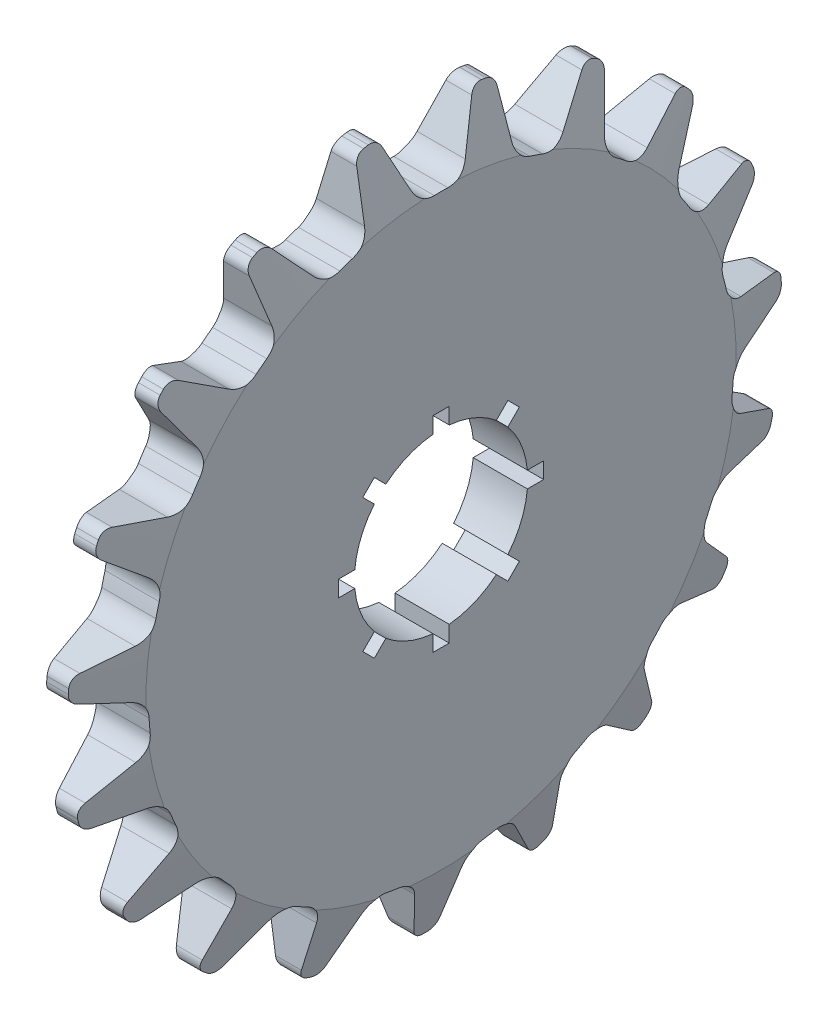
from build123d import *

# Parameters (mm, degrees)
SKETCH1_R                = 27
SKETCH1_R_2              = 22
SKETCH1_R_3              = 12
SKETCH1_R_4              = 8
BOSS_EXTRUDE1_DEPTH      = 2.5
BOSS_EXTRUDE2_DEPTH      = 5
FILLET1_R                = 1
FILLET2_R                = 2
CIRPATTERN1_COUNT        = 19
FILLET1_OF_CIRPATTERN1_R = 1
FILLET2_OF_CIRPATTERN1_R = 2
CUT_EXTRUDE1_DEPTH       = 47.87134803
CIRPATTERN2_COUNT        = 8
SKETCH1_3_R              = 22
SKETCH1_3_R_2            = 12
BOSS_EXTRUDE3_DEPTH      = 3.5
BOSS_EXTRUDE4_DEPTH      = 2
CIRPATTERN3_COUNT        = 3


with BuildPart() as part:
    # Sketch1 → Boss-Extrude1 (new, symmetric)
    # profile 1 of 3: a face of its own
    with BuildSketch(Plane.YZ):
        with Locations(Location((0, 0, 0), (0, 0, 270))):
            Circle(SKETCH1_R)
        Circle(SKETCH1_R_2, mode=Mode.SUBTRACT)
    # profile 2 of 3: a face of its own
    with BuildSketch(Plane.YZ):
        Circle(SKETCH1_R_2)
        Circle(SKETCH1_R_3, mode=Mode.SUBTRACT)
    # profile 3 of 3: a face of its own
    with BuildSketch(Plane.YZ):
        Circle(SKETCH1_R_3)
        with Locations(Location((0, 0, 0), (0, 0, 270))):
            Circle(SKETCH1_R_4, mode=Mode.SUBTRACT)
    extrude(amount=BOSS_EXTRUDE1_DEPTH, both=True)

    # Sketch2 → Boss-Extrude2 (add)
    with BuildSketch(Plane.YZ.offset(2.5)):
        with BuildLine():
            ThreePointArc((-32.984731261, 1.003744792), (-32.996182595, 0.501930459), (-33, 0))
            ThreePointArc((-33, 0), (-32.996182595, -0.501930459), (-32.984731261, -1.003744792))
            Line((-32.984731261, -1.003744792), (-26.884010118, -2.5))
            ThreePointArc((-26.884010118, -2.5), (-27, 0), (-26.884010118, 2.5))
            Line((-26.884010118, 2.5), (-32.984731261, 1.003744792))
        make_face()
    boss_extrude2 = extrude(amount=-BOSS_EXTRUDE2_DEPTH)

    # Fillet1
    fillet1_edges = [part.edges().sort_by_distance(p)[0] for p in [
        (0, -32.984731261, 1.003744792),
        (0, -32.984731261, -1.003744792),
    ]]
    fillet(fillet1_edges, radius=FILLET1_R)

    # Fillet2
    fillet2_edges = [part.edges().sort_by_distance(p)[0] for p in [
        (0, -26.884010118, 2.5),
        (0, -26.884010118, -2.5),
    ]]
    fillet(fillet2_edges, radius=FILLET2_R)

    # CirPattern1: Boss-Extrude2 ×19 about axis
    cirpattern1_axis = Axis((0, 0, 0), (1, 0, 0))
    for i in range(1, CIRPATTERN1_COUNT):
        add(boss_extrude2.rotate(cirpattern1_axis, i * 360 / CIRPATTERN1_COUNT))

    # Fillet1 of CirPattern1
    fillet1_of_cirpattern1_edges = [part.edges().sort_by_distance(p)[0] for p in [
        (0, -31.523442941, -9.760765602),
        (0, -30.871612139, -11.659483863),
        (0, -26.646100441, -19.467545589),
        (0, -25.413074819, -21.051736942),
        (0, -18.881239502, -27.064714942),
        (0, -17.200636517, -28.162707672),
        (0, -9.07030329, -31.729002478),
        (0, -7.124242354, -32.221812036),
        (0, 1.723541024, -32.954960269),
        (0, 3.724174012, -32.789183093),
        (0, 12.330612924, -30.609736766),
        (0, 14.169018338, -29.803337386),
        (0, 21.601471585, -24.947473326),
        (0, 23.078429672, -23.587837626),
        (0, 28.531475618, -16.581764051),
        (0, 29.486935052, -14.816229657),
        (0, 32.369651557, -6.419163348),
        (0, 32.700073482, -4.439053307),
        (0, 32.700073482, 4.439053307),
        (0, 32.369651557, 6.419163348),
        (0, 29.486935052, 14.816229657),
        (0, 28.531475618, 16.581764051),
        (0, 23.078429672, 23.587837626),
        (0, 21.601471585, 24.947473326),
        (0, 14.169018338, 29.803337386),
        (0, 12.330612924, 30.609736766),
        (0, 3.724174012, 32.789183093),
        (0, 1.723541024, 32.954960269),
        (0, -7.124242354, 32.221812036),
        (0, -9.07030329, 31.729002478),
        (0, -17.200636517, 28.162707672),
        (0, -18.881239502, 27.064714942),
        (0, -25.413074819, 21.051736942),
        (0, -26.646100441, 19.467545589),
        (0, -30.871612139, 11.659483863),
        (0, -31.523442941, 9.760765602),
    ]]
    fillet(fillet1_of_cirpattern1_edges, radius=FILLET1_OF_CIRPATTERN1_R)

    # Fillet2 of CirPattern1
    fillet2_of_cirpattern1_edges = [part.edges().sort_by_distance(p)[0] for p in [
        (0, -26.239108968, -6.364680711),
        (0, -24.615611622, -11.09376692),
        (0, -22.75079322, -14.539649509),
        (0, -19.679729657, -18.485352056),
        (0, -16.797076012, -21.139021676),
        (0, -12.611243621, -23.873762467),
        (0, -9.023134985, -25.44765284),
        (0, -4.176133655, -26.675080275),
        (0, -0.271397273, -26.998635957),
        (0, 4.711525192, -26.585739229),
        (0, 8.509750544, -25.623897941),
        (0, 13.088617177, -23.615420818),
        (0, 16.368734847, -21.472412987),
        (0, 20.047354401, -18.086005129),
        (0, 22.453912743, -14.994058908),
        (0, 24.833649708, -10.596690152),
        (0, 26.105860785, -6.890865889),
        (0, 26.928833736, -1.959059372),
        (0, 26.928833736, 1.959059372),
        (0, 26.105860785, 6.890865889),
        (0, 24.833649708, 10.596690152),
        (0, 22.453912743, 14.994058908),
        (0, 20.047354401, 18.086005129),
        (0, 16.368734847, 21.472412987),
        (0, 13.088617177, 23.615420818),
        (0, 8.509750544, 25.623897941),
        (0, 4.711525192, 26.585739229),
        (0, -0.271397273, 26.998635957),
        (0, -4.176133655, 26.675080275),
        (0, -9.023134985, 25.44765284),
        (0, -12.611243621, 23.873762467),
        (0, -16.797076012, 21.139021676),
        (0, -19.679729657, 18.485352056),
        (0, -22.75079322, 14.539649509),
        (0, -24.615611622, 11.09376692),
        (0, -26.239108968, 6.364680711),
    ]]
    fillet(fillet2_of_cirpattern1_edges, radius=FILLET2_OF_CIRPATTERN1_R)

    # Sketch3 → Cut-Revolve1 (revolve, cut)
    with BuildSketch(Plane(origin=(0, 0, 0), x_dir=(-1, 0, 0), z_dir=(0, 0, 1))):
        Polygon((1, 33), (2.5, 33), (2.5, 27.241411309), align=None)
        Polygon((-1, 33), (-2.5, 33), (-2.5, 27.241411309), align=None)
    revolve(axis=Axis((14.362974642, 0, 0), (-1, 0, 0)), mode=Mode.SUBTRACT)

    # Sketch4 → Cut-Extrude1 (cut, symmetric)
    with BuildSketch(Plane(origin=(-2.5, 0, 0), x_dir=(0, -1, 0), z_dir=(-1, 0, 0))):
        with BuildLine():
            ThreePointArc((-0.75, 7.964766161), (-0.37541358, 7.991186686), (0, 8))
            Line((0, 8), (0, 9.464766161))
            Line((0, 9.464766161), (-0.75, 9.464766161))
            Line((-0.75, 9.464766161), (-0.75, 7.964766161))
        make_face()
        with BuildLine():
            Line((0, 9.464766161), (0, 8))
            ThreePointArc((0, 8), (0.37541358, 7.991186686), (0.75, 7.964766161))
            Line((0.75, 7.964766161), (0.75, 9.464766161))
            Line((0.75, 9.464766161), (0, 9.464766161))
        make_face()
    cut_extrude1 = extrude(amount=CUT_EXTRUDE1_DEPTH, both=True, mode=Mode.SUBTRACT)

    # CirPattern2: Cut-Extrude1 ×8 about axis
    cirpattern2_axis = Axis((0, 0, 0), (1, 0, 0))
    for i in range(1, CIRPATTERN2_COUNT):
        add(cut_extrude1.rotate(cirpattern2_axis, i * 360 / CIRPATTERN2_COUNT), mode=Mode.SUBTRACT)

    # Sketch1<3> → Boss-Extrude3 (add)
    with BuildSketch(Plane.YZ):
        with Locations(Location((0, 0, 0), (0, 0, 270))):
            Circle(SKETCH1_3_R)
        with Locations(Location((0, 0, 0), (0, 0, 270))):
            Circle(SKETCH1_3_R_2, mode=Mode.SUBTRACT)
    extrude(amount=-BOSS_EXTRUDE3_DEPTH)

    # Sketch6 → Boss-Extrude4 (add)
    with BuildSketch(Plane(origin=(-3.5, 0, 0), x_dir=(0, -1, 0), z_dir=(-1, 0, 0))):
        Polygon((0, 14), (2.598076211, 15.5), (2.598076211, 18.5), (0, 20), (-2.598076211, 18.5), (-2.598076211, 15.5), align=None)
    boss_extrude4 = extrude(amount=BOSS_EXTRUDE4_DEPTH)

    # CirPattern3: Boss-Extrude4 ×3 about axis
    cirpattern3_axis = Axis((0, 0, 0), (1, 0, 0))
    for i in range(1, CIRPATTERN3_COUNT):
        add(boss_extrude4.rotate(cirpattern3_axis, i * 360 / CIRPATTERN3_COUNT))


solid = part.part
